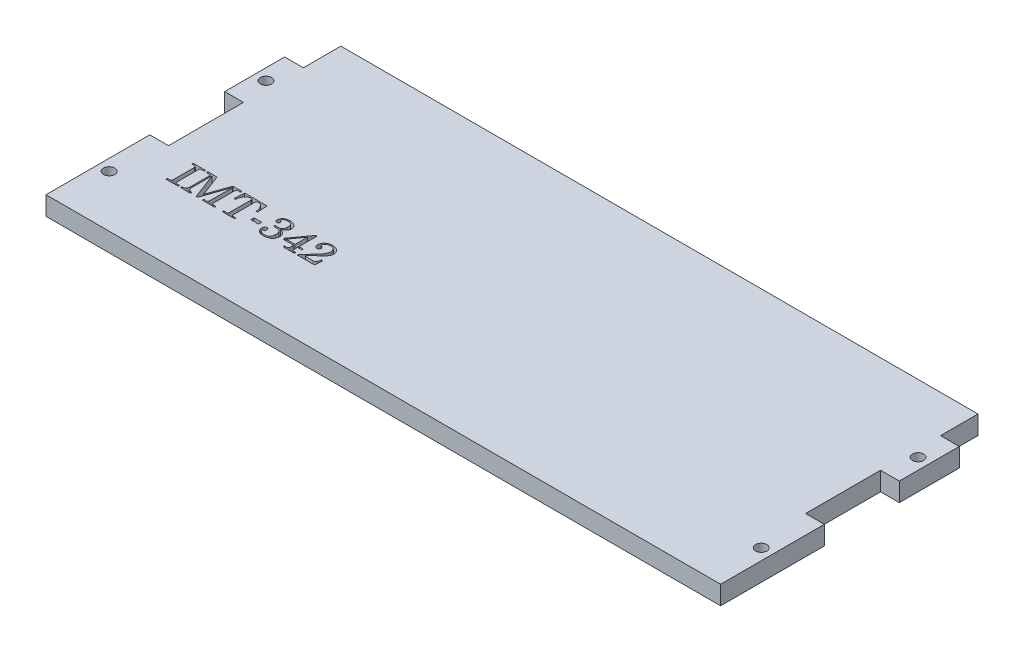
from build123d import *

# Parameters (mm, degrees)
CROQUIS1_W              = 170
CROQUIS1_H              = 20
CROQUIS1_W_2            = 180
CROQUIS1_H_2            = 16
SALIENTE_EXTRUIR1_DEPTH = 5
CROQUIS2_R              = 1.5
CORTAR_EXTRUIR1_DEPTH   = 106.949338837
CROQUIS3_W              = 170
CROQUIS3_H              = 15
SALIENTE_EXTRUIR2_DEPTH = 5
CROQUIS4_W              = 2.062322494
CROQUIS4_H              = 0.843677384
CORTAR_EXTRUIR3_DEPTH   = 106.949338837
CROQUIS5_W              = 170
CROQUIS5_H              = 5
CORTAR_EXTRUIR4_DEPTH   = 106.949338979


with BuildPart() as part:
    # Croquis1 → Saliente-Extruir1 (new body)
    with BuildSketch(Plane(origin=(0, 0, 0), x_dir=(1, 0, 0), z_dir=(0, 1, 0))):
        Polygon((90, -28), (85, -28), (-85, -28), (-90, -28), (-90, -55.68), (90, -55.68), align=None)
        with Locations((0, -18)):
            Rectangle(CROQUIS1_W, CROQUIS1_H)
        Rectangle(CROQUIS1_W_2, CROQUIS1_H_2)
    extrude(amount=SALIENTE_EXTRUIR1_DEPTH)

    # Croquis2 → Cortar-Extruir1 (cut, through all)
    with BuildSketch(Plane(origin=(0, 5, 0), x_dir=(1, 0, 0), z_dir=(0, 1, 0))):
        with Locations(Location((-87, 0, 0), (0, 0, 270))):
            Circle(CROQUIS2_R)
        with Locations(Location((-87, -41.84, 0), (0, 0, 270))):
            Circle(CROQUIS2_R)
    cortar_extruir1 = extrude(amount=-CORTAR_EXTRUIR1_DEPTH, mode=Mode.SUBTRACT)

    # Simetría1: Cortar-Extruir1 across plane
    add(cortar_extruir1.mirror(Plane(origin=(0, 0, 0), x_dir=(0, 0, 1), z_dir=(1, 0, 0))), mode=Mode.SUBTRACT)

    # Croquis3 → Saliente-Extruir2 (add)
    with BuildSketch(Plane(origin=(0, 5, 0), x_dir=(1, 0, 0), z_dir=(0, 1, 0))):
        with Locations((0, 15.5)):
            Rectangle(CROQUIS3_W, CROQUIS3_H)
    extrude(amount=-SALIENTE_EXTRUIR2_DEPTH)

    # Croquis4 → Cortar-Extruir3 (cut, through all)
    # profile 1 of 7: a face of its own
    with BuildSketch(Plane(origin=(0, 5, 0), x_dir=(1, 0, 0), z_dir=(0, 1, 0))):
        with BuildLine():
            Line((-77.640431549, -28.765885609), (-74.359463945, -28.765885609))
            Line((-74.359463945, -28.765885609), (-74.359463945, -29.140853335))
            Line((-74.359463945, -29.140853335), (-74.917521381, -29.140853335))
            add(Edge.make_bspline(
                [(-74.917521381, -29.140853335), (-74.973709829, -29.141764368), (-75.075202404, -29.143409955), (-75.211373827, -29.159363883), (-75.314680548, -29.187495331), (-75.391038628, -29.232269589), (-75.436485609, -29.303100388), (-75.463474042, -29.394458004), (-75.482458017, -29.510672697), (-75.483691258, -29.5972619), (-75.484367123, -29.644716217)],
                knots=[0, 0, 0, 0, 1.473035235, 2.660727346, 3.584016889, 4.269332832, 4.922698946, 5.732321762, 6.757222385, 8, 8, 8, 8], degree=3))
            Line((-75.484367123, -29.644716217), (-75.484367123, -35.17402546))
            add(Edge.make_bspline(
                [(-75.484367123, -35.17402546), (-75.483449834, -35.223957595), (-75.481789082, -35.314359712), (-75.465928949, -35.433668861), (-75.444441593, -35.527083538), (-75.411883637, -35.570120624), (-75.39794878, -35.588540564)],
                knots=[0, 0, 0, 0, 1.387279159, 2.511668523, 3.362991788, 4, 4, 4, 4], degree=3))
            add(Edge.make_bspline(
                [(-75.39794878, -35.588540564), (-75.375797653, -35.606520487), (-75.32790287, -35.645396365), (-75.231440732, -35.677284829), (-75.115407523, -35.699935639), (-75.029986261, -35.701782207), (-74.983433677, -35.702788543)],
                knots=[0, 0, 0, 0, 0.773484526, 1.672414867, 2.731520698, 4, 4, 4, 4], degree=3))
            Line((-74.983433677, -35.702788543), (-74.359463945, -35.702788543))
            Line((-74.359463945, -35.702788543), (-74.359463945, -36.077756269))
            Line((-74.359463945, -36.077756269), (-77.640431549, -36.077756269))
            Line((-77.640431549, -36.077756269), (-77.640431549, -35.702788543))
            Line((-77.640431549, -35.702788543), (-77.028179558, -35.702788543))
            add(Edge.make_bspline(
                [(-77.028179558, -35.702788543), (-76.979280001, -35.702076403), (-76.890296974, -35.700780515), (-76.770351345, -35.682261941), (-76.677408137, -35.653776468), (-76.605772486, -35.608586497), (-76.563660127, -35.53429213), (-76.534073016, -35.439352986), (-76.518178584, -35.315596161), (-76.516470303, -35.224342201), (-76.51552837, -35.17402546)],
                knots=[0, 0, 0, 0, 1.323224596, 2.407885381, 3.273374914, 3.948198526, 4.637756618, 5.528332226, 6.637141158, 8, 8, 8, 8], degree=3))
            Line((-76.51552837, -35.17402546), (-76.51552837, -29.644716217))
            add(Edge.make_bspline(
                [(-76.51552837, -29.644716217), (-76.516729406, -29.596787971), (-76.518881246, -29.510917164), (-76.531434997, -29.397189399), (-76.555770434, -29.310800656), (-76.587233619, -29.271605454), (-76.600481996, -29.255101314)],
                knots=[0, 0, 0, 0, 1.411879347, 2.529598496, 3.380849948, 4, 4, 4, 4], degree=3))
            add(Edge.make_bspline(
                [(-76.600481996, -29.255101314), (-76.626666586, -29.237199024), (-76.684481688, -29.197671092), (-76.796601268, -29.163694849), (-76.934198202, -29.144579541), (-77.034922707, -29.142165898), (-77.089697701, -29.140853335)],
                knots=[0, 0, 0, 0, 0.741247183, 1.636660366, 2.714792252, 4, 4, 4, 4], degree=3))
            Line((-77.089697701, -29.140853335), (-77.640431549, -29.140853335))
            Line((-77.640431549, -29.140853335), (-77.640431549, -28.765885609))
        make_face()
    # profile 2 of 7: a face of its own
    with BuildSketch(Plane(origin=(0, 5, 0), x_dir=(1, 0, 0), z_dir=(0, 1, 0))):
        with BuildLine():
            Line((-73.703270424, -28.765885609), (-71.26890964, -28.765885609))
            Line((-71.26890964, -28.765885609), (-69.063044813, -34.539802705))
            Line((-69.063044813, -34.539802705), (-67.034410826, -28.765885609))
            Line((-67.034410826, -28.765885609), (-64.610303065, -28.765885609))
            Line((-64.610303065, -28.765885609), (-64.610303065, -29.140853335))
            Line((-64.610303065, -29.140853335), (-65.203513726, -29.140853335))
            add(Edge.make_bspline(
                [(-65.203513726, -29.140853335), (-65.251905976, -29.141759209), (-65.340291394, -29.14341373), (-65.46018721, -29.159978834), (-65.555083456, -29.187995849), (-65.628311398, -29.229646192), (-65.678108013, -29.290796623), (-65.711215724, -29.366133149), (-65.73170427, -29.458134557), (-65.733974816, -29.524975958), (-65.735206244, -29.56122731)],
                knots=[0, 0, 0, 0, 1.461409083, 2.669172297, 3.644102285, 4.438396511, 5.171145089, 5.982913306, 6.9060355, 8, 8, 8, 8], degree=3))
            Line((-65.735206244, -29.56122731), (-65.735206244, -35.342467994))
            add(Edge.make_bspline(
                [(-65.735206244, -35.342467994), (-65.733516998, -35.370004828), (-65.73031019, -35.422279824), (-65.705721183, -35.496516187), (-65.664233595, -35.560427997), (-65.603755179, -35.614058628), (-65.523340456, -35.655051437), (-65.420952657, -35.683445405), (-65.29584399, -35.700088872), (-65.204547269, -35.701841045), (-65.155178042, -35.702788543)],
                knots=[0, 0, 0, 0, 0.852734016, 1.618801414, 2.395714484, 3.189123744, 4.096684287, 5.169862416, 6.469586829, 8, 8, 8, 8], degree=3))
            Line((-65.155178042, -35.702788543), (-64.610303065, -35.702788543))
            Line((-64.610303065, -35.702788543), (-64.610303065, -36.077756269))
            Line((-64.610303065, -36.077756269), (-67.891270669, -36.077756269))
            Line((-67.891270669, -36.077756269), (-67.891270669, -35.702788543))
            Line((-67.891270669, -35.702788543), (-67.280483396, -35.702788543))
            add(Edge.make_bspline(
                [(-67.280483396, -35.702788543), (-67.239394153, -35.701936999), (-67.162556589, -35.700344599), (-67.055632467, -35.681854712), (-66.965726463, -35.649690636), (-66.892169907, -35.605518097), (-66.835387755, -35.550514025), (-66.794950779, -35.487851075), (-66.769666408, -35.417555485), (-66.767492518, -35.368075025), (-66.766367491, -35.342467994)],
                knots=[0, 0, 0, 0, 1.394235928, 2.607244209, 3.666761408, 4.619311681, 5.498637875, 6.326439516, 7.133902247, 8, 8, 8, 8], degree=3))
            Line((-66.766367491, -35.342467994), (-66.766367491, -29.136459182))
            Line((-66.766367491, -29.136459182), (-69.205122428, -36.077756269))
            Line((-69.205122428, -36.077756269), (-69.562513542, -36.077756269))
            Line((-69.562513542, -36.077756269), (-72.20339952, -29.165753536))
            Line((-72.20339952, -29.165753536), (-72.20339952, -34.476819845))
            add(Edge.make_bspline(
                [(-72.20339952, -34.476819845), (-72.202060807, -34.55108153), (-72.199562391, -34.68967472), (-72.179935138, -34.883000044), (-72.146239549, -35.04713119), (-72.096574803, -35.18429773), (-72.030431289, -35.296768413), (-71.957276146, -35.395757599), (-71.869505078, -35.479333107), (-71.768170016, -35.553514482), (-71.641129959, -35.611816637), (-71.483057406, -35.653210328), (-71.292559984, -35.687220354), (-71.153362641, -35.697343748), (-71.078496341, -35.702788543)],
                knots=[0, 0, 0, 0, 1.387005521, 2.588542367, 3.624266538, 4.510231893, 5.298685798, 6.05383917, 6.802021236, 7.553697037, 8.390065714, 9.394768359, 10.598794723, 12, 12, 12, 12], degree=3))
            Line((-71.078496341, -35.702788543), (-71.078496341, -36.077756269))
            Line((-71.078496341, -36.077756269), (-73.703270424, -36.077756269))
            Line((-73.703270424, -36.077756269), (-73.703270424, -35.702788543))
            add(Edge.make_bspline(
                [(-73.703270424, -35.702788543), (-73.650473384, -35.698492165), (-73.549487656, -35.690274415), (-73.404888091, -35.669143711), (-73.273200441, -35.644464605), (-73.155532123, -35.609132265), (-73.04886615, -35.573657767), (-72.958136188, -35.524737912), (-72.877232326, -35.475246903), (-72.811410911, -35.413886182), (-72.753475674, -35.345505642), (-72.708264287, -35.26337047), (-72.665538054, -35.172124016), (-72.635247374, -35.0670601), (-72.607748579, -34.951468351), (-72.591964035, -34.823293734), (-72.578953243, -34.684099718), (-72.578567558, -34.587199868), (-72.578367246, -34.536873269)],
                knots=[0, 0, 0, 0, 1.3499974, 2.582161247, 3.724551801, 4.760625632, 5.713431081, 6.581852865, 7.382807722, 8.122943763, 8.865587329, 9.657594863, 10.504338807, 11.429508857, 12.438001628, 13.531119739, 14.71774469, 16, 16, 16, 16], degree=3))
            Line((-72.578367246, -34.536873269), (-72.578367246, -29.501173885))
            add(Edge.make_bspline(
                [(-72.578367246, -29.501173885), (-72.57968163, -29.471742806), (-72.582150568, -29.416459473), (-72.602642566, -29.339828726), (-72.637075572, -29.275401036), (-72.688066743, -29.222624644), (-72.759757021, -29.183783575), (-72.852860481, -29.159342429), (-72.968432501, -29.143666245), (-73.053359194, -29.141847843), (-73.09980674, -29.140853335)],
                knots=[0, 0, 0, 0, 0.964066467, 1.810902258, 2.577654402, 3.336338785, 4.182417323, 5.216170427, 6.47748631, 8, 8, 8, 8], degree=3))
            Line((-73.09980674, -29.140853335), (-73.703270424, -29.140853335))
            Line((-73.703270424, -29.140853335), (-73.703270424, -28.765885609))
        make_face()
    # profile 3 of 7: a face of its own
    with BuildSketch(Plane(origin=(0, 5, 0), x_dir=(1, 0, 0), z_dir=(0, 1, 0))):
        with BuildLine():
            Line((-63.883803096, -28.765885609), (-57.925331573, -28.765885609))
            Line((-57.925331573, -28.765885609), (-57.767142063, -31.484401624))
            Line((-57.767142063, -31.484401624), (-58.142109789, -31.484401624))
            add(Edge.make_bspline(
                [(-58.142109789, -31.484401624), (-58.156989193, -31.389552849), (-58.185849099, -31.205585353), (-58.2401461, -30.939640041), (-58.302301887, -30.69200857), (-58.374782462, -30.463068242), (-58.452250693, -30.251097893), (-58.542732933, -30.059085452), (-58.63821394, -29.883587362), (-58.744698727, -29.727985212), (-58.85682766, -29.588164772), (-58.981089671, -29.46973008), (-59.11159989, -29.36687551), (-59.252387768, -29.284621864), (-59.401064252, -29.219090956), (-59.558907222, -29.174583915), (-59.724371568, -29.145162961), (-59.837633498, -29.142308567), (-59.895376853, -29.140853335)],
                knots=[0, 0, 0, 0, 1.432451823, 2.778365615, 4.048814831, 5.240071754, 6.360497384, 7.41327137, 8.404638267, 9.338184166, 10.223433942, 11.073572704, 11.894005427, 12.697408972, 13.500019358, 14.311606187, 15.139220712, 16, 16, 16, 16], degree=3))
            add(Edge.make_bspline(
                [(-59.895376853, -29.140853335), (-59.938906993, -29.141660293), (-60.01962927, -29.143156714), (-60.129857801, -29.161524586), (-60.218834503, -29.191358659), (-60.288595072, -29.234607997), (-60.335640818, -29.296970177), (-60.36968819, -29.371258798), (-60.387759162, -29.462282779), (-60.390457873, -29.527468382), (-60.391916146, -29.562692027)],
                knots=[0, 0, 0, 0, 1.373378458, 2.546792513, 3.512211499, 4.324574211, 5.092577234, 5.940998757, 6.88739958, 8, 8, 8, 8], degree=3))
            Line((-60.391916146, -29.562692027), (-60.391916146, -35.360044606))
            add(Edge.make_bspline(
                [(-60.391916146, -35.360044606), (-60.391127165, -35.387538416), (-60.38963933, -35.439385306), (-60.369683483, -35.511457439), (-60.339659474, -35.572967337), (-60.294515516, -35.622631791), (-60.234428986, -35.660194474), (-60.159270096, -35.685417779), (-60.06872279, -35.699391027), (-60.003819028, -35.701593718), (-59.968612737, -35.702788543)],
                knots=[0, 0, 0, 0, 1.048245625, 1.976745847, 2.836833363, 3.643156965, 4.508094636, 5.517888877, 6.65360768, 8, 8, 8, 8], degree=3))
            Line((-59.968612737, -35.702788543), (-59.267012968, -35.702788543))
            Line((-59.267012968, -35.702788543), (-59.267012968, -36.077756269))
            Line((-59.267012968, -36.077756269), (-62.547980572, -36.077756269))
            Line((-62.547980572, -36.077756269), (-62.547980572, -35.702788543))
            Line((-62.547980572, -35.702788543), (-61.751174154, -35.702788543))
            add(Edge.make_bspline(
                [(-61.751174154, -35.702788543), (-61.726227869, -35.701476188), (-61.678802247, -35.698981257), (-61.611588027, -35.685458823), (-61.55441687, -35.658096305), (-61.506469564, -35.621343423), (-61.47035013, -35.574647955), (-61.440496284, -35.523129806), (-61.426996029, -35.462227668), (-61.424422779, -35.420134875), (-61.423077393, -35.398127265)],
                knots=[0, 0, 0, 0, 1.182923075, 2.248866389, 3.221156285, 4.16015494, 5.08104171, 6.001928481, 6.955337164, 8, 8, 8, 8], degree=3))
            Line((-61.423077393, -35.398127265), (-61.423077393, -29.518750497))
            add(Edge.make_bspline(
                [(-61.423077393, -29.518750497), (-61.424488037, -29.489354843), (-61.4271604, -29.433666918), (-61.447036835, -29.35484576), (-61.484915101, -29.28896083), (-61.536785179, -29.233781599), (-61.604741196, -29.191044025), (-61.689337348, -29.160020728), (-61.791086601, -29.143843631), (-61.864394025, -29.141893672), (-61.903504792, -29.140853335)],
                knots=[0, 0, 0, 0, 1.008377174, 1.910297138, 2.757863652, 3.587197201, 4.483814459, 5.485493234, 6.658467561, 8, 8, 8, 8], degree=3))
            add(Edge.make_bspline(
                [(-61.903504792, -29.140853335), (-61.962227905, -29.142767604), (-62.078060848, -29.146543551), (-62.247953961, -29.178249938), (-62.409952501, -29.230125805), (-62.565825205, -29.300383784), (-62.712181725, -29.394343841), (-62.852991495, -29.505855161), (-62.983320092, -29.64087452), (-63.062470116, -29.741161683), (-63.103108572, -29.792652703)],
                knots=[0, 0, 0, 0, 0.991941037, 1.9566308, 2.909208852, 3.861929869, 4.837255463, 5.841206404, 6.891598091, 8, 8, 8, 8], degree=3))
            add(Edge.make_bspline(
                [(-63.103108572, -29.792652703), (-63.135669865, -29.839979998), (-63.203301137, -29.938280922), (-63.292178106, -30.102213343), (-63.373691792, -30.285595314), (-63.448078334, -30.488293646), (-63.515276189, -30.709888742), (-63.574434598, -30.950683577), (-63.629487464, -31.210379177), (-63.658091504, -31.390997148), (-63.67288375, -31.484401624)],
                knots=[0, 0, 0, 0, 0.765022806, 1.588986829, 2.480046904, 3.437147945, 4.464044908, 5.563778044, 6.740136255, 8, 8, 8, 8], degree=3))
            Line((-63.67288375, -31.484401624), (-64.047851476, -31.484401624))
            Line((-64.047851476, -31.484401624), (-63.883803096, -28.765885609))
        make_face()
    # profile 4 of 7: a face of its own
    with BuildSketch(Plane(origin=(0, 5, 0), x_dir=(1, 0, 0), z_dir=(0, 1, 0))):
        with Locations((-55.892303433, -33.687337015)):
            Rectangle(CROQUIS4_W, CROQUIS4_H)
    # profile 5 of 7: a face of its own
    with BuildSketch(Plane(origin=(0, 5, 0), x_dir=(1, 0, 0), z_dir=(0, 1, 0))):
        with BuildLine():
            add(Edge.make_bspline(
                [(-50.717455868, -32.373485256), (-50.661098332, -32.38841339), (-50.550394774, -32.417736844), (-50.391360302, -32.472633826), (-50.240692094, -32.531536688), (-50.101757827, -32.601674908), (-49.969962386, -32.675629564), (-49.849314491, -32.759539734), (-49.736457708, -32.848316769), (-49.669587837, -32.914768102), (-49.63649422, -32.947654586)],
                knots=[0, 0, 0, 0, 1.127986332, 2.215712516, 3.254519764, 4.256084105, 5.225389863, 6.176843843, 7.097727707, 8, 8, 8, 8], degree=3))
            add(Edge.make_bspline(
                [(-49.63649422, -32.947654586), (-49.597039526, -32.990856245), (-49.51936124, -33.075911543), (-49.41891221, -33.215493041), (-49.333949329, -33.362353535), (-49.262674847, -33.51695385), (-49.20881874, -33.679698411), (-49.170909851, -33.849994746), (-49.146522564, -34.027419338), (-49.144110207, -34.14864179), (-49.142884362, -34.210241227)],
                knots=[0, 0, 0, 0, 1.008576721, 1.985682883, 2.95929833, 3.931638003, 4.917057036, 5.91004102, 6.937983068, 8, 8, 8, 8], degree=3))
            add(Edge.make_bspline(
                [(-49.142884362, -34.210241227), (-49.144405491, -34.279663553), (-49.147385713, -34.415677019), (-49.17561289, -34.61409925), (-49.222854227, -34.801439728), (-49.287191325, -34.978628774), (-49.371186325, -35.145391869), (-49.474859966, -35.300849327), (-49.594560323, -35.447890262), (-49.688555091, -35.533515809), (-49.736095023, -35.576822822)],
                knots=[0, 0, 0, 0, 1.081911166, 2.119699739, 3.116678628, 4.089624726, 5.053054498, 6.020026414, 6.998584595, 8, 8, 8, 8], degree=3))
            add(Edge.make_bspline(
                [(-49.736095023, -35.576822822), (-49.793826631, -35.624331026), (-49.909102239, -35.719193046), (-50.097636216, -35.841450777), (-50.299766475, -35.942075098), (-50.513796482, -36.026430032), (-50.740843758, -36.092036824), (-50.981002407, -36.138663078), (-51.233326768, -36.167010495), (-51.405798102, -36.169982511), (-51.493756239, -36.171498201)],
                knots=[0, 0, 0, 0, 0.945160241, 1.887249016, 2.834525177, 3.796660852, 4.793372442, 5.819178135, 6.88780922, 8, 8, 8, 8], degree=3))
            add(Edge.make_bspline(
                [(-51.493756239, -36.171498201), (-51.598877114, -36.169295454), (-51.802168347, -36.165035606), (-52.095200338, -36.123108982), (-52.365614292, -36.05641364), (-52.612101456, -35.963014306), (-52.832883032, -35.846172424), (-53.024817432, -35.708254199), (-53.1873706, -35.550865253), (-53.320092446, -35.375411519), (-53.423454526, -35.184164142), (-53.494854057, -34.979266227), (-53.540880915, -34.763505012), (-53.546100157, -34.615229371), (-53.548755144, -34.539802705)],
                knots=[0, 0, 0, 0, 1.282312936, 2.479840266, 3.604266281, 4.675566184, 5.68860086, 6.644574492, 7.550601464, 8.439695557, 9.319535424, 10.192182052, 11.080377051, 12, 12, 12, 12], degree=3))
            add(Edge.make_bspline(
                [(-53.548755144, -34.539802705), (-53.54714369, -34.480556645), (-53.544079851, -34.367912782), (-53.511498095, -34.208526419), (-53.457784275, -34.068642476), (-53.382156262, -33.950484547), (-53.292159847, -33.853722724), (-53.186955838, -33.784950304), (-53.070716383, -33.740746706), (-52.988655034, -33.736418086), (-52.946756178, -33.734207981)],
                knots=[0, 0, 0, 0, 1.263624466, 2.402514909, 3.455721656, 4.444849685, 5.381369533, 6.254646324, 7.108857899, 8, 8, 8, 8], degree=3))
            add(Edge.make_bspline(
                [(-52.946756178, -33.734207981), (-52.908966964, -33.736111592), (-52.836534811, -33.739760324), (-52.732895499, -33.769747247), (-52.642407196, -33.822446554), (-52.563756472, -33.893594769), (-52.500457236, -33.982532258), (-52.454508948, -34.087065192), (-52.42833661, -34.206528233), (-52.425393561, -34.290668702), (-52.423851966, -34.33474223)],
                knots=[0, 0, 0, 0, 1.009688416, 1.93531162, 2.853721346, 3.787507251, 4.751486804, 5.751245704, 6.822082462, 8, 8, 8, 8], degree=3))
            add(Edge.make_bspline(
                [(-52.423851966, -34.33474223), (-52.424450755, -34.363631923), (-52.425596224, -34.418897199), (-52.441225979, -34.498641971), (-52.464999056, -34.57182328), (-52.501981459, -34.637828693), (-52.548209081, -34.70058039), (-52.611585885, -34.756488892), (-52.686856464, -34.813473262), (-52.744654769, -34.846138363), (-52.775384209, -34.863505312)],
                knots=[0, 0, 0, 0, 1.026388534, 1.96345617, 2.88099264, 3.751773542, 4.644802383, 5.6405901, 6.745580084, 8, 8, 8, 8], degree=3))
            add(Edge.make_bspline(
                [(-52.775384209, -34.863505312), (-52.806687072, -34.881306386), (-52.862508751, -34.913050634), (-52.930509139, -34.965317795), (-52.976305483, -35.018619487), (-52.98322268, -35.058241836), (-52.986303555, -35.075889376)],
                knots=[0, 0, 0, 0, 1.385949906, 2.471532716, 3.319230472, 4, 4, 4, 4], degree=3))
            add(Edge.make_bspline(
                [(-52.986303555, -35.075889376), (-52.984574836, -35.101029371), (-52.980950726, -35.153733208), (-52.949681964, -35.23335758), (-52.901945053, -35.316323131), (-52.838496042, -35.404155658), (-52.754679186, -35.487909689), (-52.654483638, -35.567125951), (-52.53435152, -35.632929736), (-52.398295437, -35.693035257), (-52.24271116, -35.738775503), (-52.068132763, -35.772193865), (-51.875051262, -35.792398354), (-51.739878785, -35.795115971), (-51.669522361, -35.796530474)],
                knots=[0, 0, 0, 0, 0.55206785, 1.15736276, 1.860117588, 2.6600171, 3.534269137, 4.461140486, 5.462574158, 6.541080506, 7.731452296, 9.023910158, 10.450963948, 12, 12, 12, 12], degree=3))
            add(Edge.make_bspline(
                [(-51.669522361, -35.796530474), (-51.607958273, -35.795494097), (-51.488956575, -35.793490809), (-51.316584442, -35.775629932), (-51.156281108, -35.746773758), (-51.008077948, -35.706007113), (-50.871823547, -35.653898404), (-50.74981326, -35.586847231), (-50.638591367, -35.510640844), (-50.53930102, -35.421866282), (-50.451766285, -35.319637274), (-50.377347773, -35.202936397), (-50.313330358, -35.07242871), (-50.263886927, -34.927295978), (-50.221219287, -34.769099264), (-50.195570325, -34.596109814), (-50.176886864, -34.409362959), (-50.175015076, -34.280113591), (-50.174045609, -34.213170662)],
                knots=[0, 0, 0, 0, 1.17526087, 2.271747113, 3.304893507, 4.282007042, 5.203028837, 6.083228734, 6.93405606, 7.772535496, 8.618907528, 9.49554545, 10.408653604, 11.387588912, 12.418714315, 13.532970673, 14.722236147, 16, 16, 16, 16], degree=3))
            add(Edge.make_bspline(
                [(-50.174045609, -34.213170662), (-50.174748964, -34.143331353), (-50.176108191, -34.008367588), (-50.190368996, -33.814082646), (-50.215852113, -33.63573882), (-50.247540472, -33.472375071), (-50.294666698, -33.325833056), (-50.344947972, -33.192509435), (-50.411025173, -33.077437437), (-50.484450613, -32.975913179), (-50.56911707, -32.889177082), (-50.662114797, -32.813317495), (-50.765314699, -32.750280205), (-50.877751376, -32.699331175), (-50.998481756, -32.657086403), (-51.130109281, -32.630773122), (-51.2705951, -32.612287821), (-51.367724173, -32.610316759), (-51.41759092, -32.609304802)],
                knots=[0, 0, 0, 0, 1.43665822, 2.776327635, 4.003630587, 5.142236511, 6.193827761, 7.167456487, 8.066972832, 8.914754127, 9.738758292, 10.55290854, 11.378075042, 12.218505752, 13.088835859, 14.002926975, 14.974688722, 16, 16, 16, 16], degree=3))
            add(Edge.make_bspline(
                [(-51.41759092, -32.609304802), (-51.479597301, -32.609304802), (-51.617280763, -32.609304802), (-51.754964225, -32.609304802), (-51.830641305, -32.609304802)],
                knots=[0, 0, 0, 0, 0.90070922, 2, 2, 2, 2], degree=3))
            add(Edge.make_bspline(
                [(-51.830641305, -32.609304802), (-51.861400377, -32.609304802), (-51.918524366, -32.609304802), (-51.997130882, -32.609304802), (-52.062066699, -32.609304802), (-52.100637598, -32.609304802), (-52.117725971, -32.609304802)],
                knots=[0, 0, 0, 0, 1.285714286, 2.387755102, 3.285714286, 4, 4, 4, 4], degree=3))
            add(Edge.make_bspline(
                [(-52.117725971, -32.609304802), (-52.161604503, -32.607447821), (-52.240461303, -32.604110526), (-52.342161164, -32.566116368), (-52.40986284, -32.501320382), (-52.419364011, -32.447325741), (-52.423851966, -32.421820939)],
                knots=[0, 0, 0, 0, 1.321883868, 2.375638526, 3.232719832, 4, 4, 4, 4], degree=3))
            add(Edge.make_bspline(
                [(-52.423851966, -32.421820939), (-52.423421294, -32.407415011), (-52.422587157, -32.379513204), (-52.404108047, -32.342288562), (-52.380885307, -32.307693153), (-52.343354276, -32.281971006), (-52.296828658, -32.25922267), (-52.237674655, -32.2439125), (-52.166789211, -32.23579784), (-52.115798155, -32.23484725), (-52.088431617, -32.234337076)],
                knots=[0, 0, 0, 0, 0.793318051, 1.536520765, 2.276728694, 3.093046233, 4.030133891, 5.158963281, 6.475235763, 8, 8, 8, 8], degree=3))
            Line((-52.088431617, -32.234337076), (-51.80867054, -32.234337076))
            Line((-51.80867054, -32.234337076), (-51.564062688, -32.234337076))
            add(Edge.make_bspline(
                [(-51.564062688, -32.234337076), (-51.511785775, -32.233653134), (-51.410427546, -32.232327059), (-51.263477329, -32.217580491), (-51.126867224, -32.192776019), (-51.00006069, -32.158841147), (-50.882540432, -32.117517565), (-50.775814629, -32.063655099), (-50.67846465, -32.001354687), (-50.621203049, -31.951393245), (-50.592954866, -31.926746363)],
                knots=[0, 0, 0, 0, 1.202444693, 2.331386062, 3.393401613, 4.393425414, 5.34931994, 6.253590109, 7.138464433, 8, 8, 8, 8], degree=3))
            add(Edge.make_bspline(
                [(-50.592954866, -31.926746363), (-50.566819052, -31.900055168), (-50.514205068, -31.846323147), (-50.447892464, -31.752421675), (-50.392787393, -31.647557179), (-50.345491527, -31.533625883), (-50.310377121, -31.408666933), (-50.28642815, -31.273225337), (-50.269320892, -31.12744202), (-50.268307549, -31.026486362), (-50.267787541, -30.974679871)],
                knots=[0, 0, 0, 0, 0.865649001, 1.742637258, 2.654837953, 3.60985059, 4.599438976, 5.65921447, 6.798800512, 8, 8, 8, 8], degree=3))
            add(Edge.make_bspline(
                [(-50.267787541, -30.974679871), (-50.268307733, -30.911169088), (-50.269313972, -30.788316452), (-50.286059701, -30.611742987), (-50.310940016, -30.44938366), (-50.343022694, -30.300664908), (-50.389570627, -30.16688546), (-50.442265286, -30.045935048), (-50.50796742, -29.940445733), (-50.582797892, -29.848191079), (-50.66988887, -29.770644508), (-50.763369699, -29.700385212), (-50.868558362, -29.643898095), (-50.98228691, -29.596436478), (-51.10611541, -29.560204402), (-51.239861911, -29.533582576), (-51.383616612, -29.519809511), (-51.482502003, -29.517174684), (-51.533303616, -29.515821062)],
                knots=[0, 0, 0, 0, 1.367270292, 2.644791198, 3.815135222, 4.904304233, 5.915134873, 6.861045676, 7.739319172, 8.583444393, 9.409565187, 10.244471915, 11.096224634, 11.972986253, 12.894505262, 13.869878539, 14.905666382, 16, 16, 16, 16], degree=3))
            add(Edge.make_bspline(
                [(-51.533303616, -29.515821062), (-51.624717535, -29.517893435), (-51.799015303, -29.521844802), (-52.046085454, -29.556034566), (-52.264659813, -29.615584377), (-52.449692736, -29.697618709), (-52.597463014, -29.790439882), (-52.706889279, -29.87852841), (-52.781859999, -29.965870432), (-52.793599266, -30.030493561), (-52.798819692, -30.059231321)],
                knots=[0, 0, 0, 0, 1.500830099, 2.861613836, 4.085321305, 5.208855254, 6.174409921, 6.937221288, 7.527384704, 8, 8, 8, 8], degree=3))
            add(Edge.make_bspline(
                [(-52.798819692, -30.059231321), (-52.796134658, -30.078699517), (-52.790036595, -30.122914331), (-52.746960862, -30.187742236), (-52.687263692, -30.26294459), (-52.634637749, -30.311877802), (-52.605476958, -30.338992398)],
                knots=[0, 0, 0, 0, 0.671435625, 1.52491796, 2.628521485, 4, 4, 4, 4], degree=3))
            add(Edge.make_bspline(
                [(-52.605476958, -30.338992398), (-52.563925847, -30.377651267), (-52.485594688, -30.45053004), (-52.397015199, -30.575274128), (-52.341270596, -30.704181831), (-52.333760588, -30.792567929), (-52.330110034, -30.835531691)],
                knots=[0, 0, 0, 0, 1.161721737, 2.190049961, 3.120198028, 4, 4, 4, 4], degree=3))
            add(Edge.make_bspline(
                [(-52.330110034, -30.835531691), (-52.331633399, -30.867001609), (-52.334595957, -30.928202623), (-52.362859346, -31.015872446), (-52.406900118, -31.096162341), (-52.469314581, -31.165841225), (-52.543252945, -31.225292471), (-52.630659909, -31.266450447), (-52.727551296, -31.292105064), (-52.79572095, -31.295275157), (-52.831043481, -31.296917761)],
                knots=[0, 0, 0, 0, 0.99041816, 1.926112268, 2.87790552, 3.860623519, 4.859276906, 5.85161077, 6.886798738, 8, 8, 8, 8], degree=3))
            add(Edge.make_bspline(
                [(-52.831043481, -31.296917761), (-52.868419695, -31.294693659), (-52.9413686, -31.290352776), (-53.045540115, -31.255222049), (-53.138497645, -31.196648431), (-53.217940616, -31.114432092), (-53.28252605, -31.012251609), (-53.329409945, -30.891528681), (-53.357247989, -30.753302672), (-53.359885152, -30.655508349), (-53.361271281, -30.604106298)],
                knots=[0, 0, 0, 0, 0.914529605, 1.784930204, 2.661479224, 3.583883105, 4.563218599, 5.605461961, 6.741397641, 8, 8, 8, 8], degree=3))
            add(Edge.make_bspline(
                [(-53.361271281, -30.604106298), (-53.360152997, -30.562060487), (-53.357945395, -30.479057939), (-53.340088044, -30.356187667), (-53.308940988, -30.237080359), (-53.266151637, -30.121612794), (-53.21370647, -30.008986491), (-53.14666073, -29.90142013), (-53.067410361, -29.797646766), (-53.007797668, -29.732171365), (-52.977515249, -29.698910772)],
                knots=[0, 0, 0, 0, 0.999716682, 1.973538595, 2.945211935, 3.922420343, 4.898938583, 5.894736118, 6.930555213, 8, 8, 8, 8], degree=3))
            add(Edge.make_bspline(
                [(-52.977515249, -29.698910772), (-52.930680062, -29.654273614), (-52.836425388, -29.56444242), (-52.67599062, -29.450844164), (-52.501072537, -29.355304697), (-52.31267787, -29.274921248), (-52.108133472, -29.216534797), (-51.889843668, -29.171992773), (-51.65698246, -29.145666151), (-51.496752232, -29.142483766), (-51.414661484, -29.140853335)],
                knots=[0, 0, 0, 0, 0.909754859, 1.830859522, 2.756669209, 3.711384822, 4.707307673, 5.745077135, 6.844735444, 8, 8, 8, 8], degree=3))
            add(Edge.make_bspline(
                [(-51.414661484, -29.140853335), (-51.337457359, -29.142084998), (-51.186093618, -29.144499753), (-50.965757258, -29.168431768), (-50.757163643, -29.206532737), (-50.560944034, -29.258706807), (-50.375943253, -29.326523845), (-50.203405967, -29.409377634), (-50.043049059, -29.508889312), (-49.896681411, -29.622692259), (-49.763315475, -29.745909326), (-49.64849843, -29.879294516), (-49.54948339, -30.017858327), (-49.469755562, -30.165237418), (-49.405853765, -30.319022017), (-49.362693131, -30.481146816), (-49.335057181, -30.65002771), (-49.331952027, -30.765113671), (-49.330368225, -30.82381395)],
                knots=[0, 0, 0, 0, 1.235787073, 2.422841437, 3.543695518, 4.628389263, 5.669647038, 6.694100641, 7.687664546, 8.685279823, 9.658742038, 10.589782533, 11.498567567, 12.380147193, 13.267151977, 14.158486823, 15.060725253, 16, 16, 16, 16], degree=3))
            add(Edge.make_bspline(
                [(-49.330368225, -30.82381395), (-49.33111228, -30.865841555), (-49.332587772, -30.949184113), (-49.347347148, -31.071789623), (-49.372663966, -31.189698238), (-49.406420151, -31.303512518), (-49.449782278, -31.413262689), (-49.505423879, -31.517725212), (-49.567445431, -31.619255677), (-49.64227239, -31.715293121), (-49.727679026, -31.808774789), (-49.828039124, -31.897512496), (-49.941330103, -31.984555731), (-50.069811668, -32.067521063), (-50.211069242, -32.149692441), (-50.367851674, -32.226763261), (-50.537092036, -32.303231891), (-50.656195941, -32.349623953), (-50.717455868, -32.373485256)],
                knots=[0, 0, 0, 0, 0.901539039, 1.787790923, 2.644636588, 3.486556976, 4.332833442, 5.171619147, 6.023389924, 6.882538254, 7.779683682, 8.736734891, 9.753022938, 10.842694193, 12.016124602, 13.257727958, 14.589539223, 16, 16, 16, 16], degree=3))
        make_face()
    # profile 6 of 7: a face of its own
    with BuildSketch(Plane(origin=(0, 5, 0), x_dir=(1, 0, 0), z_dir=(0, 1, 0))):
        with BuildLine():
            Line((-44.662312978, -29.140853335), (-44.268303922, -29.140853335))
            Line((-44.268303922, -29.140853335), (-44.268303922, -33.921691844))
            Line((-44.268303922, -33.921691844), (-43.143400744, -33.921691844))
            Line((-43.143400744, -33.921691844), (-43.143400744, -34.29665957))
            Line((-43.143400744, -34.29665957), (-44.268303922, -34.29665957))
            Line((-44.268303922, -34.29665957), (-44.268303922, -35.362974041))
            add(Edge.make_bspline(
                [(-44.268303922, -35.362974041), (-44.266998873, -35.385163996), (-44.264435445, -35.428750363), (-44.24107662, -35.489770111), (-44.205475407, -35.545000008), (-44.171543437, -35.572766071), (-44.154055943, -35.587075846)],
                knots=[0, 0, 0, 0, 1.016247676, 1.996152923, 2.967278868, 4, 4, 4, 4], degree=3))
            add(Edge.make_bspline(
                [(-44.154055943, -35.587075846), (-44.125836508, -35.605316544), (-44.069884555, -35.641483202), (-43.975277324, -35.6754556), (-43.875957115, -35.69907721), (-43.807068555, -35.701531018), (-43.771764629, -35.702788543)],
                knots=[0, 0, 0, 0, 0.991158648, 1.965215167, 2.957215921, 4, 4, 4, 4], degree=3))
            Line((-43.771764629, -35.702788543), (-43.330884607, -35.702788543))
            Line((-43.330884607, -35.702788543), (-43.330884607, -36.077756269))
            Line((-43.330884607, -36.077756269), (-46.330626416, -36.077756269))
            Line((-46.330626416, -36.077756269), (-46.330626416, -35.702788543))
            Line((-46.330626416, -35.702788543), (-45.81065164, -35.702788543))
            add(Edge.make_bspline(
                [(-45.81065164, -35.702788543), (-45.76953363, -35.70148903), (-45.692574965, -35.699056793), (-45.585785138, -35.678738811), (-45.495217449, -35.646031304), (-45.422392769, -35.596327146), (-45.367008896, -35.53280895), (-45.326266397, -35.457522619), (-45.302715813, -35.368749707), (-45.30058741, -35.305507305), (-45.299465169, -35.272161545)],
                knots=[0, 0, 0, 0, 1.289348386, 2.413213323, 3.397780663, 4.290294409, 5.147930762, 6.01860763, 6.955273149, 8, 8, 8, 8], degree=3))
            Line((-45.299465169, -35.272161545), (-45.299465169, -34.29665957))
            Line((-45.299465169, -34.29665957), (-48.111723115, -34.29665957))
            Line((-48.111723115, -34.29665957), (-48.111723115, -33.889468055))
            Line((-48.111723115, -33.889468055), (-44.662312978, -29.140853335))
        make_face()
        Polygon((-45.299465169, -30.620218192), (-47.698672729, -33.921691844), (-45.299465169, -33.921691844), align=None, mode=Mode.SUBTRACT)
    # profile 7 of 7: a face of its own
    with BuildSketch(Plane(origin=(0, 5, 0), x_dir=(1, 0, 0), z_dir=(0, 1, 0))):
        with BuildLine():
            add(Edge.make_bspline(
                [(-41.32129195, -35.036341998), (-41.328689865, -35.047526143), (-41.342452901, -35.068333057), (-41.33903572, -35.108940673), (-41.308606263, -35.14090632), (-41.260946185, -35.167589822), (-41.193881848, -35.193885286), (-41.105128558, -35.21584255), (-40.995720744, -35.237899802), (-40.865006924, -35.25584825), (-40.713715697, -35.273972228), (-40.541173728, -35.287561719), (-40.347388011, -35.301248117), (-40.132497858, -35.311156136), (-39.896632885, -35.317904743), (-39.63982671, -35.324284429), (-39.361503366, -35.326603471), (-39.168645075, -35.327404896), (-39.068556157, -35.327820817)],
                knots=[0, 0, 0, 0, 0.264522454, 0.492115977, 0.758469058, 1.116905389, 1.594696211, 2.206856012, 2.960861016, 3.847548454, 4.869807865, 6.037241621, 7.341541194, 8.792334255, 10.380264796, 12.105895113, 13.979051144, 16, 16, 16, 16], degree=3))
            add(Edge.make_bspline(
                [(-39.068556157, -35.327820817), (-39.010759834, -35.325352126), (-38.902622361, -35.320733181), (-38.75243152, -35.285604866), (-38.629003484, -35.221403025), (-38.54645641, -35.143407633), (-38.492415713, -35.061049888), (-38.452797234, -34.975920495), (-38.408769243, -34.870579235), (-38.363375207, -34.742599896), (-38.319172185, -34.592087745), (-38.272323037, -34.419577529), (-38.222052971, -34.225569877), (-38.191254199, -34.087794693), (-38.175078373, -34.015433775)],
                knots=[0, 0, 0, 0, 1.181004775, 2.209671203, 3.12485452, 3.993073648, 4.496817558, 5.130576657, 5.908980013, 6.830669454, 7.904106987, 9.114595617, 10.484556503, 12, 12, 12, 12], degree=3))
            Line((-38.175078373, -34.015433775), (-37.800110646, -34.015433775))
            Line((-37.800110646, -34.015433775), (-37.975876768, -36.077756269))
            Line((-37.975876768, -36.077756269), (-42.487207223, -36.077756269))
            Line((-42.487207223, -36.077756269), (-42.487207223, -35.82436011))
            Line((-42.487207223, -35.82436011), (-41.003448213, -34.191199897))
            add(Edge.make_bspline(
                [(-41.003448213, -34.191199897), (-40.905256654, -34.087745431), (-40.718851638, -33.891349413), (-40.454816743, -33.611461958), (-40.221975853, -33.361865917), (-40.021642907, -33.14096846), (-39.849042206, -32.953471177), (-39.71085732, -32.792609145), (-39.599231619, -32.665431238), (-39.539391014, -32.587103093), (-39.513830332, -32.55364553)],
                knots=[0, 0, 0, 0, 1.545890058, 2.934688704, 4.17028174, 5.24526459, 6.166829156, 6.931941195, 7.543782827, 8, 8, 8, 8], degree=3))
            add(Edge.make_bspline(
                [(-39.513830332, -32.55364553), (-39.457652713, -32.475232134), (-39.348501334, -32.322877324), (-39.206094317, -32.089680686), (-39.08765834, -31.860232538), (-38.994249257, -31.634972172), (-38.922290651, -31.41690166), (-38.870561166, -31.208400579), (-38.837725488, -31.009898651), (-38.833376936, -30.880563494), (-38.831271893, -30.817955079)],
                knots=[0, 0, 0, 0, 1.221342228, 2.373030247, 3.457097868, 4.48831189, 5.458191672, 6.362523757, 7.207332364, 8, 8, 8, 8], degree=3))
            add(Edge.make_bspline(
                [(-38.831271893, -30.817955079), (-38.832595581, -30.768610473), (-38.83517022, -30.672632752), (-38.849422945, -30.532389064), (-38.875286103, -30.40024159), (-38.914148209, -30.277156921), (-38.960540564, -30.161136342), (-39.019906552, -30.054057909), (-39.088527691, -29.953974392), (-39.168245983, -29.862675647), (-39.257047258, -29.780986472), (-39.354916483, -29.709818516), (-39.460802652, -29.650021408), (-39.574282194, -29.599449322), (-39.696719387, -29.561416905), (-39.827402819, -29.535849508), (-39.966004402, -29.51921163), (-40.06109645, -29.516972101), (-40.109970428, -29.515821062)],
                knots=[0, 0, 0, 0, 1.144811332, 2.226715166, 3.266231702, 4.262137236, 5.217010938, 6.159784736, 7.096004777, 8.02721036, 8.965073134, 9.889365439, 10.827775152, 11.781102716, 12.766194483, 13.794607472, 14.866505594, 16, 16, 16, 16], degree=3))
            add(Edge.make_bspline(
                [(-40.109970428, -29.515821062), (-40.165187877, -29.516365674), (-40.273433869, -29.51743331), (-40.43140702, -29.534557136), (-40.581556583, -29.559377538), (-40.724618666, -29.592142325), (-40.858938714, -29.638149804), (-40.986158068, -29.692262603), (-41.105380989, -29.756941302), (-41.214970433, -29.830977707), (-41.314704303, -29.910027263), (-41.402157744, -29.991119526), (-41.476489935, -30.073783172), (-41.537321964, -30.157550686), (-41.584277053, -30.242754308), (-41.619626972, -30.328898206), (-41.638360032, -30.417290078), (-41.641817795, -30.476602708), (-41.643529839, -30.505970213)],
                knots=[0, 0, 0, 0, 1.326433612, 2.60028531, 3.813684945, 4.983463278, 6.122649585, 7.221225408, 8.302875734, 9.376861028, 10.395780236, 11.358844163, 12.239770449, 13.063676203, 13.84097391, 14.573117523, 15.293506644, 16, 16, 16, 16], degree=3))
            add(Edge.make_bspline(
                [(-41.643529839, -30.505970213), (-41.64216186, -30.542798222), (-41.639663179, -30.610066377), (-41.601989296, -30.665458589), (-41.584941132, -30.690524641)],
                knots=[0, 0, 0, 0, 1.094961168, 2, 2, 2, 2], degree=3))
            add(Edge.make_bspline(
                [(-41.584941132, -30.690524641), (-41.57360093, -30.701278281), (-41.54792608, -30.725625121), (-41.495313682, -30.753449075), (-41.428163866, -30.779495266), (-41.37805755, -30.794875531), (-41.350586303, -30.803307902)],
                knots=[0, 0, 0, 0, 0.710690112, 1.609041988, 2.689135369, 4, 4, 4, 4], degree=3))
            add(Edge.make_bspline(
                [(-41.350586303, -30.803307902), (-41.314576572, -30.813475008), (-41.245109482, -30.833088574), (-41.150887268, -30.878465224), (-41.071512339, -30.935340265), (-41.005086659, -31.001819001), (-40.955390658, -31.081368147), (-40.917714491, -31.170077218), (-40.897784101, -31.27066672), (-40.895033852, -31.340780233), (-40.893594387, -31.377477233)],
                knots=[0, 0, 0, 0, 1.118595343, 2.15790461, 3.111021168, 4.030836712, 4.951116574, 5.901090488, 6.901443123, 8, 8, 8, 8], degree=3))
            add(Edge.make_bspline(
                [(-40.893594387, -31.377477233), (-40.895384118, -31.417263038), (-40.898867165, -31.49469132), (-40.931284657, -31.604891223), (-40.981296525, -31.706039638), (-41.053688882, -31.792416096), (-41.139641238, -31.866242362), (-41.241950424, -31.915308343), (-41.353953884, -31.948005878), (-41.432850277, -31.95137182), (-41.473622588, -31.953111281)],
                knots=[0, 0, 0, 0, 1.041125866, 2.026164562, 2.988296164, 3.980302212, 4.962423256, 5.935991559, 6.933355608, 8, 8, 8, 8], degree=3))
            add(Edge.make_bspline(
                [(-41.473622588, -31.953111281), (-41.520956436, -31.949628073), (-41.615991867, -31.942634596), (-41.752429966, -31.888138239), (-41.878346323, -31.799492984), (-41.992283631, -31.679814268), (-42.089530991, -31.532821721), (-42.155590565, -31.360175583), (-42.200270722, -31.169311971), (-42.204027571, -31.034526099), (-42.205981429, -30.964426847)],
                knots=[0, 0, 0, 0, 0.83205251, 1.670569209, 2.548472486, 3.527734868, 4.565379759, 5.630600578, 6.767725999, 8, 8, 8, 8], degree=3))
            add(Edge.make_bspline(
                [(-42.205981429, -30.964426847), (-42.202913393, -30.883642308), (-42.196850734, -30.724006221), (-42.147721617, -30.490530523), (-42.063610431, -30.269963866), (-41.950993578, -30.060023021), (-41.80285532, -29.865326343), (-41.620812365, -29.688739244), (-41.405352048, -29.531321575), (-41.161992021, -29.394271831), (-40.896668698, -29.282116922), (-40.617799534, -29.199704459), (-40.328042666, -29.14990406), (-40.13164691, -29.143892866), (-40.032340391, -29.140853335)],
                knots=[0, 0, 0, 0, 0.920453742, 1.818883095, 2.704880925, 3.603999707, 4.525765236, 5.482253031, 6.485303894, 7.559571233, 8.659544837, 9.762092633, 10.86841348, 12, 12, 12, 12], degree=3))
            add(Edge.make_bspline(
                [(-40.032340391, -29.140853335), (-39.933994405, -29.143833342), (-39.739989399, -29.149711936), (-39.454871486, -29.200002928), (-39.180766307, -29.280178159), (-38.922021027, -29.393207754), (-38.682866845, -29.528952369), (-38.471120518, -29.68698804), (-38.292807577, -29.868129012), (-38.147916217, -30.067752402), (-38.03412719, -30.28137236), (-37.953050901, -30.506226257), (-37.902886111, -30.741042658), (-37.896881939, -30.901198158), (-37.893852578, -30.982003459)],
                knots=[0, 0, 0, 0, 1.125553274, 2.220354679, 3.304870239, 4.389270482, 5.446207922, 6.448192551, 7.405024832, 8.34559417, 9.263572082, 10.167392221, 11.075370971, 12, 12, 12, 12], degree=3))
            add(Edge.make_bspline(
                [(-37.893852578, -30.982003459), (-37.895840576, -31.03919067), (-37.899849256, -31.154505273), (-37.923295109, -31.327852511), (-37.965507554, -31.502001578), (-38.022264842, -31.676341384), (-38.093272862, -31.848771582), (-38.181270547, -32.015914686), (-38.282636837, -32.177962225), (-38.361212254, -32.279867726), (-38.400644895, -32.331008443)],
                knots=[0, 0, 0, 0, 0.935020729, 1.885413617, 2.853338986, 3.860387131, 4.880132302, 5.897532329, 6.944888138, 8, 8, 8, 8], degree=3))
            add(Edge.make_bspline(
                [(-38.400644895, -32.331008443), (-38.471535243, -32.416730717), (-38.610468783, -32.58473242), (-38.830400686, -32.819507398), (-39.051761517, -33.036696942), (-39.205545806, -33.16958798), (-39.280940221, -33.234739252)],
                knots=[0, 0, 0, 0, 1.056246566, 2.070071318, 3.053831537, 4, 4, 4, 4], degree=3))
            Line((-39.280940221, -33.234739252), (-40.59479198, -34.330348076))
            add(Edge.make_bspline(
                [(-40.59479198, -34.330348076), (-40.672444692, -34.39616998), (-40.819155432, -34.520528548), (-41.017959546, -34.704293259), (-41.184489545, -34.872434321), (-41.278010665, -34.984485199), (-41.32129195, -35.036341998)],
                knots=[0, 0, 0, 0, 1.203835763, 2.274429704, 3.201411408, 4, 4, 4, 4], degree=3))
        make_face()
    extrude(amount=-CORTAR_EXTRUIR3_DEPTH, mode=Mode.SUBTRACT)


with BuildPart() as cortar_extruir3_piece_1:
    # of the separate pieces the step leaves, piece 1, a body of its own (cortar_extruir3_pieces)
    add(part.part.solids().sort_by_distance((-90, 0, 8))[0])

    # Croquis5 → Cortar-Extruir4 (cut, through all)
    with BuildSketch(Plane(origin=(0, 5, 0), x_dir=(1, 0, 0), z_dir=(0, 1, 0))):
        with Locations((0, 20.5)):
            Rectangle(CROQUIS5_W, CROQUIS5_H)
    extrude(amount=-CORTAR_EXTRUIR4_DEPTH, mode=Mode.SUBTRACT)


with BuildPart() as cortar_extruir3_piece_2:
    # of the separate pieces the step leaves, piece 2, a body of its own (cortar_extruir3_pieces)
    add(part.part.solids().sort_by_distance((-45.299465169, 0, 33.921691844))[0])


solid = Compound([cortar_extruir3_piece_1.part, cortar_extruir3_piece_2.part])
